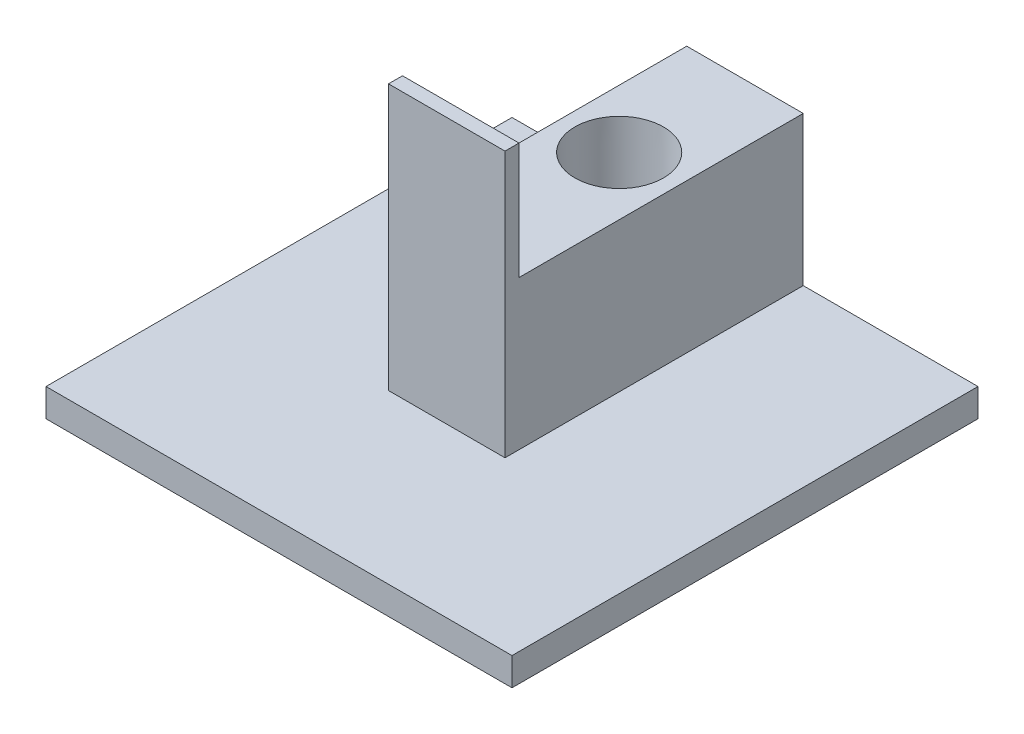
from build123d import *

# Parameters (mm, degrees)
SKETCH1_W           = 100
SKETCH1_H           = 100
BOSS_EXTRUDE1_DEPTH = 38
SKETCH3_R           = 3
BOSS_EXTRUDE2_DEPTH = 3
SKETCH4_R           = 8.25
SKETCH5_R           = 9.5
SKETCH6_W           = 25
SKETCH6_H           = 3
BOSS_EXTRUDE3_DEPTH = 25
CUT_EXTRUDE3_DEPTH  = 32


with BuildPart() as part:
    # Sketch1 → Boss-Extrude1 (new body)
    with BuildSketch(Plane(origin=(0, 0, 0), x_dir=(1, 0, 0), z_dir=(0, 1, 0))):
        with Locations((1.25, -24.285714286)):
            Rectangle(SKETCH1_W, SKETCH1_H)
    extrude(amount=BOSS_EXTRUDE1_DEPTH)

    # Sketch3 → Boss-Extrude2 (add)
    with BuildSketch(Plane.XZ):
        with Locations(Location((-27.034271247, 52.569985533, 0), (0, 0, 90))):
            Circle(SKETCH3_R)
        with Locations(Location((29.534271247, 52.569985533, 0), (0, 0, 90))):
            Circle(SKETCH3_R)
        with Locations(Location((29.534271247, -3.998556962, 0), (0, 0, 90))):
            Circle(SKETCH3_R)
        with Locations(Location((-27.034271247, -3.998556962, 0), (0, 0, 90))):
            Circle(SKETCH3_R)
    extrude(amount=BOSS_EXTRUDE2_DEPTH)

    # Sketch4 → Cut-Loft1 section 0
    with BuildSketch(Plane.XZ):
        with Locations((1.25, 1.285714286)):
            Circle(SKETCH4_R)
    # Sketch5 → Cut-Loft1 section 1
    with BuildSketch(Plane(origin=(0, 38, 0), x_dir=(1, 0, 0), z_dir=(0, 1, 0))):
        with Locations((1.25, -1.285714286)):
            Circle(SKETCH5_R)
    loft(mode=Mode.SUBTRACT)

    # Sketch6 → Boss-Extrude3 (add)
    with BuildSketch(Plane(origin=(0, 38, 0), x_dir=(1, 0, 0), z_dir=(0, 1, 0))):
        with Locations((1.25, -36.785714286)):
            Rectangle(SKETCH6_W, SKETCH6_H)
    extrude(amount=BOSS_EXTRUDE3_DEPTH)

    # Sketch9 → Cut-Extrude3 (cut)
    with BuildSketch(Plane(origin=(0, 38, 0), x_dir=(1, 0, 0), z_dir=(0, 1, 0))):
        Polygon((-49.799740752, 27.751403127), (-11.25, 27.751403127), (-11.25, -38.285714286), (13.75, -38.285714286), (13.75, 28.556619644), (53.406913463, 28.556619644), (53.406913463, -79.342393637), (26.184866917, -79.342393637), (26.184866917, -84.038284162), (-21.600270932, -84.038284162), (-21.600270932, -78.738481249), (-49.799740752, -78.738481249), align=None)
    extrude(amount=-CUT_EXTRUDE3_DEPTH, mode=Mode.SUBTRACT)


solid = part.part
